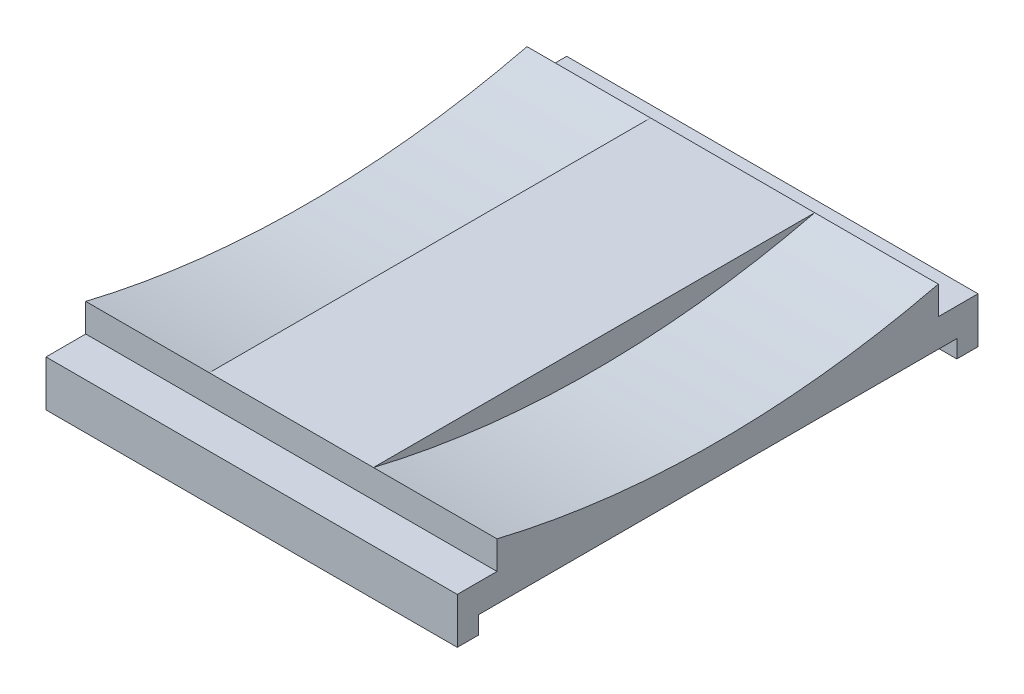
from build123d import *

# Parameters (mm, degrees)
BOSS_EXTRUDE1_DEPTH = 23.3
BOSS_EXTRUDE2_REACH = 41.551
SKETCH2_W           = 9.3
SKETCH2_H           = 1.6
CUT_EXTRUDE2_DEPTH  = 1.6


with BuildPart() as part:
    # Sketch1 → Boss-Extrude1 (new body)
    with BuildSketch(Plane(origin=(0, 0, 0), x_dir=(0, 0, -1), z_dir=(1, 0, 0))):
        with BuildLine():
            Line((-43.625137797, -16.697262805), (-43.625137797, -15.697262805))
            Line((-43.625137797, -15.697262805), (-16.525137797, -15.697262805))
            Line((-16.525137797, -15.697262805), (-16.525137797, -16.697262805))
            Line((-16.525137797, -16.697262805), (-15.325137797, -16.697262805))
            Line((-15.325137797, -16.697262805), (-15.325137797, -14.097262805))
            Line((-15.325137797, -14.097262805), (-17.575137797, -14.097262805))
            Line((-17.575137797, -14.097262805), (-17.575137797, -12.497262805))
            ThreePointArc((-17.575137797, -12.497262805), (-30.075137797, -13.985375722), (-42.575137797, -12.497262805))
            Line((-42.575137797, -12.497262805), (-42.575137797, -14.097262805))
            Line((-42.575137797, -14.097262805), (-44.825137797, -14.097262805))
            Line((-44.825137797, -14.097262805), (-44.825137797, -16.697262805))
            Line((-44.825137797, -16.697262805), (-43.625137797, -16.697262805))
        make_face()
    extrude(amount=BOSS_EXTRUDE1_DEPTH)

    # Sketch2 → Boss-Extrude2 (add, up to next)
    with BuildSketch(Plane.XY.offset(42.575137797), mode=Mode.PRIVATE) as boss_extrude2_sk1:
        with Locations((11.65, -13.297262805)):
            Rectangle(SKETCH2_W, SKETCH2_H)
    boss_extrude2_tool1 = extrude(boss_extrude2_sk1.sketch, amount=-BOSS_EXTRUDE2_REACH, mode=Mode.PRIVATE) - part.part
    add(boss_extrude2_tool1.solids().sort_by_distance((11.65, -13.297263, 42.575138))[0])

    # Sketch3 → Cut-Extrude2 (cut)
    with BuildSketch(Plane.XZ.offset(15.697262805)):
        with BuildLine():
            ThreePointArc((21.3, 39.625137797), (19.885786438, 40.210924235), (19.3, 41.625137797))
            Line((19.3, 41.625137797), (4, 41.625137797))
            ThreePointArc((4, 41.625137797), (3.414213562, 40.210924235), (2, 39.625137797))
            Line((2, 39.625137797), (2, 38.425137797))
            Line((2, 38.425137797), (9, 38.425137797))
            Line((9, 38.425137797), (9, 21.725137797))
            Line((9, 21.725137797), (2, 21.725137797))
            Line((2, 21.725137797), (2, 20.525137797))
            ThreePointArc((2, 20.525137797), (3.414213562, 19.939351359), (4, 18.525137797))
            Line((4, 18.525137797), (19.3, 18.525137797))
            ThreePointArc((19.3, 18.525137797), (19.885786438, 19.939351359), (21.3, 20.525137797))
            Line((21.3, 20.525137797), (21.3, 21.725137797))
            Line((21.3, 21.725137797), (14.3, 21.725137797))
            Line((14.3, 21.725137797), (14.3, 38.425137797))
            Line((14.3, 38.425137797), (21.3, 38.425137797))
            Line((21.3, 38.425137797), (21.3, 39.625137797))
        make_face()
    extrude(amount=-CUT_EXTRUDE2_DEPTH, mode=Mode.SUBTRACT)


solid = part.part
